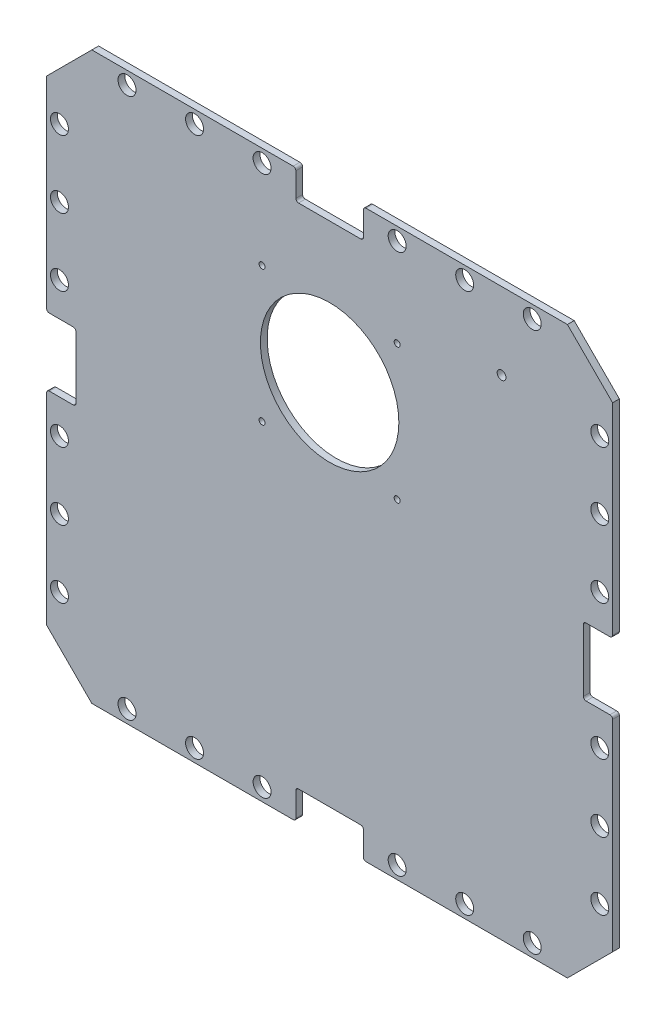
from build123d import *

# Parameters (mm, degrees)
SKETCH1_R             = 3.379999993
SKETCH1_R_2           = 3.379999996
SKETCH1_R_3           = 3.379999998
SKETCH1_R_4           = 1.13
SKETCH1_R_5           = 3.38
SKETCH1_R_6           = 26.035
SKETCH1_R_7           = 1.663100761
BOSS_EXTRUDE1_DEPTH   = 2.54
F_4_40_TAPPED_HOLE1_D = 2.2606
FILLET1_R             = 1


with BuildPart() as part:
    # Sketch1 → Boss-Extrude1 (new body)
    with BuildSketch(Plane.XY):
        Polygon((93.726, 0), (16.997849999, 0), (0, -16.997849999), (0, -93.726000007), (11, -93.726000007), (11, -119.126000007), (0, -119.126000007), (0, -195.854150007), (16.997849999, -212.852000007), (93.726000007, -212.852000007), (93.726000007, -201.852000007), (119.126000007, -201.852000007), (119.126000007, -212.852000007), (195.854150007, -212.852000007), (212.852000007, -195.854150007), (212.852000007, -119.126), (201.852000007, -119.126), (201.852000007, -93.726), (212.852000007, -93.726), (212.852000007, -16.997849999), (195.854150007, 0), (119.126, 0), (119.126, -11), (93.726, -11), align=None)
        with Locations((30.226, -208.026000005)):
            Circle(SKETCH1_R, mode=Mode.SUBTRACT)
        with Locations((4.825999998, -182.626000003)):
            Circle(SKETCH1_R_2, mode=Mode.SUBTRACT)
        with Locations((55.626, -208.026000005)):
            Circle(SKETCH1_R, mode=Mode.SUBTRACT)
        with Locations((81.026, -208.026000005)):
            Circle(SKETCH1_R, mode=Mode.SUBTRACT)
        with Locations((4.825999998, -157.226000003)):
            Circle(SKETCH1_R_2, mode=Mode.SUBTRACT)
        with Locations((4.825999998, -131.826000003)):
            Circle(SKETCH1_R_2, mode=Mode.SUBTRACT)
        with Locations((131.826, -208.026000005)):
            Circle(SKETCH1_R, mode=Mode.SUBTRACT)
        with Locations((157.226, -208.026000005)):
            Circle(SKETCH1_R, mode=Mode.SUBTRACT)
        with Locations((182.626, -208.026000005)):
            Circle(SKETCH1_R, mode=Mode.SUBTRACT)
        with Locations((208.026000002, -182.626000003)):
            Circle(SKETCH1_R_3, mode=Mode.SUBTRACT)
        with Locations((208.026000002, -157.226000003)):
            Circle(SKETCH1_R_3, mode=Mode.SUBTRACT)
        with Locations((208.026000002, -131.826000003)):
            Circle(SKETCH1_R_3, mode=Mode.SUBTRACT)
        with Locations((4.825999998, -81.026000003)):
            Circle(SKETCH1_R_2, mode=Mode.SUBTRACT)
        with Locations((4.825999998, -55.626000003)):
            Circle(SKETCH1_R_2, mode=Mode.SUBTRACT)
        with Locations((81.026000003, -89.00415)):
            Circle(SKETCH1_R_4, mode=Mode.SUBTRACT)
        with Locations((4.825999998, -30.226000003)):
            Circle(SKETCH1_R_2, mode=Mode.SUBTRACT)
        with Locations((30.226, -4.826000001)):
            Circle(SKETCH1_R_5, mode=Mode.SUBTRACT)
        with Locations((81.026000003, -38.20415)):
            Circle(SKETCH1_R_4, mode=Mode.SUBTRACT)
        with Locations((55.626, -4.826000001)):
            Circle(SKETCH1_R_5, mode=Mode.SUBTRACT)
        with Locations((81.026, -4.826000001)):
            Circle(SKETCH1_R_5, mode=Mode.SUBTRACT)
        with Locations((131.826000003, -89.00415)):
            Circle(SKETCH1_R_4, mode=Mode.SUBTRACT)
        with Locations((106.426000003, -63.60415)):
            Circle(SKETCH1_R_6, mode=Mode.SUBTRACT)
        with Locations((208.026000002, -81.026000003)):
            Circle(SKETCH1_R_3, mode=Mode.SUBTRACT)
        with Locations((208.026000002, -55.626000003)):
            Circle(SKETCH1_R_3, mode=Mode.SUBTRACT)
        with Locations((131.826000003, -38.20415)):
            Circle(SKETCH1_R_4, mode=Mode.SUBTRACT)
        with Locations((131.826, -4.826000001)):
            Circle(SKETCH1_R_5, mode=Mode.SUBTRACT)
        with Locations((157.226, -4.826000001)):
            Circle(SKETCH1_R_5, mode=Mode.SUBTRACT)
        with Locations((171.093920154, -28.877267348)):
            Circle(SKETCH1_R_7, mode=Mode.SUBTRACT)
        with Locations((208.026000002, -30.226000003)):
            Circle(SKETCH1_R_3, mode=Mode.SUBTRACT)
        with Locations((182.626, -4.826000001)):
            Circle(SKETCH1_R_5, mode=Mode.SUBTRACT)
    extrude(amount=BOSS_EXTRUDE1_DEPTH)

    # #4-40 Tapped Hole1 (through all)
    with Locations(Plane(origin=(81.026000003, -38.20415, 2.54), x_dir=(1, 0, 0), z_dir=(0, 0, 1))):
        with Locations((0, 0), (50.8, 0), (50.8, -50.8), (0, -50.8)):
            Hole(F_4_40_TAPPED_HOLE1_D / 2)

    # Fillet1
    fillet1_edges = [part.edges().sort_by_distance(p)[0] for p in [
        (0, -119.126000007, 1.27),
        (11, -119.126000007, 1.27),
        (11, -93.726000007, 1.27),
        (0, -93.726000007, 1.27),
        (93.726, 0, 1.27),
        (93.726, -11, 1.27),
        (119.126, -11, 1.27),
        (119.126, 0, 1.27),
        (212.852000007, -93.726, 1.27),
        (201.852000007, -93.726, 1.27),
        (201.852000007, -119.126, 1.27),
        (212.852000007, -119.126, 1.27),
        (119.126000007, -212.852000007, 1.27),
        (119.126000007, -201.852000007, 1.27),
        (93.726000007, -201.852000007, 1.27),
        (93.726000007, -212.852000007, 1.27),
    ]]
    fillet(fillet1_edges, radius=FILLET1_R)


solid = part.part
